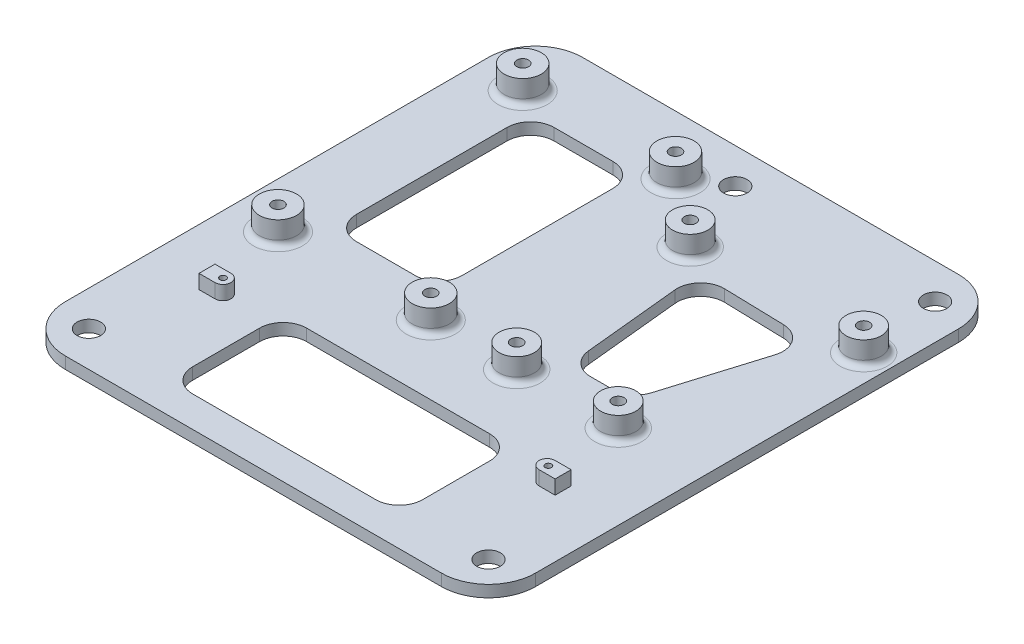
from build123d import *

# Parameters (mm, degrees)
BOSS_EXTRUDE5_DEPTH = 3.175
SKETCH2_R           = 5.0165
SKETCH2_R_2         = 1.5875
SKETCH2_R_3         = 4.7625
BOSS_EXTRUDE6_DEPTH = 6.35
CUT_EXTRUDE1_START  = -2.54
CUT_EXTRUDE1_DEPTH  = 2.54
SKETCH4_R           = 3.175
CUT_EXTRUDE2_DEPTH  = 3.175
FILLET1_R           = 1.5875
SKETCH5_R           = 0.8509
CUT_EXTRUDE3_DEPTH  = 6.35


with BuildPart() as part:
    # Sketch1 → Boss-Extrude5 (new body)
    with BuildSketch(Plane(origin=(0, 0, 0), x_dir=(1, 0, 0), z_dir=(0, 1, 0))):
        with BuildLine():
            Line((12.7, 0), (114.3, 0))
            ThreePointArc((114.3, 0), (123.280256121, -3.719743879), (127, -12.7))
            Line((127, -12.7), (127, -127))
            ThreePointArc((127, -127), (123.280256121, -135.980256121), (114.3, -139.7))
            Line((114.3, -139.7), (12.7, -139.7))
            ThreePointArc((12.7, -139.7), (3.719743879, -135.980256121), (0, -127))
            Line((0, -127), (0, -12.7))
            ThreePointArc((0, -12.7), (3.719743879, -3.719743879), (12.7, 0))
        make_face()
    extrude(amount=BOSS_EXTRUDE5_DEPTH)

    # Sketch2 → Boss-Extrude6 (add)
    # profile 1 of 10: a face of its own
    with BuildSketch(Plane(origin=(0, 3.175, 0), x_dir=(1, 0, 0), z_dir=(0, 1, 0))):
        with Locations(Location((12.3825, -15.84325, 0), (0, 0, 270))):
            Circle(SKETCH2_R)
        with Locations(Location((12.3825, -15.84325, 0), (0, 0, 270))):
            Circle(SKETCH2_R_2, mode=Mode.SUBTRACT)
    # profile 2 of 10: a face of its own
    with BuildSketch(Plane(origin=(0, 3.175, 0), x_dir=(1, 0, 0), z_dir=(0, 1, 0))):
        with Locations(Location((53.6575, -15.84325, 0), (0, 0, 270))):
            Circle(SKETCH2_R)
        with Locations(Location((53.6575, -15.84325, 0), (0, 0, 270))):
            Circle(SKETCH2_R_2, mode=Mode.SUBTRACT)
    # profile 3 of 10: a face of its own
    with BuildSketch(Plane(origin=(0, 3.175, 0), x_dir=(1, 0, 0), z_dir=(0, 1, 0))):
        with Locations(Location((71.628, -29.845, 0), (0, 0, 270))):
            Circle(SKETCH2_R_3)
        with Locations(Location((71.628, -29.845, 0), (0, 0, 270))):
            Circle(SKETCH2_R_2, mode=Mode.SUBTRACT)
    # profile 4 of 10: a face of its own
    with BuildSketch(Plane(origin=(0, 3.175, 0), x_dir=(1, 0, 0), z_dir=(0, 1, 0))):
        with Locations(Location((119.761, -31.115, 0), (0, 0, 270))):
            Circle(SKETCH2_R_3)
        with Locations(Location((119.761, -31.115, 0), (0, 0, 270))):
            Circle(SKETCH2_R_2, mode=Mode.SUBTRACT)
    # profile 5 of 10: a face of its own
    with BuildSketch(Plane(origin=(0, 3.175, 0), x_dir=(1, 0, 0), z_dir=(0, 1, 0))):
        with Locations(Location((104.267, -81.915, 0), (0, 0, 270))):
            Circle(SKETCH2_R_3)
        with Locations(Location((104.267, -81.915, 0), (0, 0, 270))):
            Circle(SKETCH2_R_2, mode=Mode.SUBTRACT)
    # profile 6 of 10: a face of its own
    with BuildSketch(Plane(origin=(0, 3.175, 0), x_dir=(1, 0, 0), z_dir=(0, 1, 0))):
        with Locations(Location((76.835, -81.915, 0), (0, 0, 270))):
            Circle(SKETCH2_R_3)
        with Locations(Location((76.835, -81.915, 0), (0, 0, 270))):
            Circle(SKETCH2_R_2, mode=Mode.SUBTRACT)
    # profile 7 of 10: a face of its own
    with BuildSketch(Plane(origin=(0, 3.175, 0), x_dir=(1, 0, 0), z_dir=(0, 1, 0))):
        with Locations(Location((53.6575, -81.94675, 0), (0, 0, 270))):
            Circle(SKETCH2_R)
        with Locations(Location((53.6575, -81.94675, 0), (0, 0, 270))):
            Circle(SKETCH2_R_2, mode=Mode.SUBTRACT)
    # profile 8 of 10: a face of its own
    with BuildSketch(Plane(origin=(0, 3.175, 0), x_dir=(1, 0, 0), z_dir=(0, 1, 0))):
        with Locations(Location((12.3825, -81.94675, 0), (0, 0, 270))):
            Circle(SKETCH2_R)
        with Locations(Location((12.3825, -81.94675, 0), (0, 0, 270))):
            Circle(SKETCH2_R_2, mode=Mode.SUBTRACT)
    # profile 9 of 10: a face of its own
    with BuildSketch(Plane(origin=(0, 3.175, 0), x_dir=(1, 0, 0), z_dir=(0, 1, 0))):
        with BuildLine():
            Line((15.24, -106.1339), (15.24, -101.8159))
            Line((15.24, -101.8159), (19.558, -101.8159))
            ThreePointArc((19.558, -101.8159), (21.717, -103.9749), (19.558, -106.1339))
            Line((19.558, -106.1339), (15.24, -106.1339))
        make_face()
    # profile 10 of 10: a face of its own
    with BuildSketch(Plane(origin=(0, 3.175, 0), x_dir=(1, 0, 0), z_dir=(0, 1, 0))):
        with BuildLine():
            Line((107.1118, -101.8159), (111.4298, -101.8159))
            Line((111.4298, -101.8159), (111.4298, -106.1339))
            Line((111.4298, -106.1339), (107.1118, -106.1339))
            ThreePointArc((107.1118, -106.1339), (104.9528, -103.9749), (107.1118, -101.8159))
        make_face()
    extrude(amount=BOSS_EXTRUDE6_DEPTH)

    # Sketch3 → Cut-Extrude1 (cut)
    with BuildSketch(Plane(origin=(0, 9.525, 0), x_dir=(1, 0, 0), z_dir=(0, 1, 0)).offset(CUT_EXTRUDE1_START)):
        with BuildLine():
            Line((19.558, -101.8159), (15.24, -101.8159))
            Line((15.24, -101.8159), (15.24, -106.1339))
            Line((15.24, -106.1339), (19.558, -106.1339))
            ThreePointArc((19.558, -106.1339), (21.717, -103.9749), (19.558, -101.8159))
        make_face()
        with BuildLine():
            Line((111.4298, -101.8159), (111.4298, -106.1339))
            Line((111.4298, -106.1339), (107.1118, -106.1339))
            ThreePointArc((107.1118, -106.1339), (104.9528, -103.9749), (107.1118, -101.8159))
            Line((107.1118, -101.8159), (111.4298, -101.8159))
        make_face()
    extrude(amount=CUT_EXTRUDE1_DEPTH, mode=Mode.SUBTRACT)

    # Sketch4 → Cut-Extrude2 (cut)
    with BuildSketch(Plane.XZ):
        with Locations(Location((117.475, 130.175, 0), (0, 0, 270))):
            Circle(SKETCH4_R)
        with Locations(Location((117.475, 9.525, 0), (0, 0, 270))):
            Circle(SKETCH4_R)
        with Locations(Location((9.525, 130.175, 0), (0, 0, 270))):
            Circle(SKETCH4_R)
        with Locations(Location((63.5, 9.525, 0), (0, 0, 270))):
            Circle(SKETCH4_R)
        with BuildLine():
            Line((32.423317369, 106.950716075), (32.423317369, 125.042120111))
            ThreePointArc((32.423317369, 125.042120111), (34.283189309, 129.532248172), (38.773317369, 131.392120111))
            Line((38.773317369, 131.392120111), (88.227117369, 131.392120111))
            ThreePointArc((88.227117369, 131.392120111), (92.71724543, 129.532248172), (94.577117369, 125.042120111))
            Line((94.577117369, 125.042120111), (94.577117369, 106.950716075))
            ThreePointArc((94.577117369, 106.950716075), (92.71724543, 102.460588015), (88.227117369, 100.600716075))
            Line((88.227117369, 100.600716075), (38.773317369, 100.600716075))
            ThreePointArc((38.773317369, 100.600716075), (34.283189309, 102.460588015), (32.423317369, 106.950716075))
        make_face()
        with BuildLine():
            Line((82.17517325, 67.888968727), (79.579189386, 41.929130088))
            ThreePointArc((79.579189386, 41.929130088), (81.246059, 36.974670742), (86.065163428, 34.949490691))
            Line((86.065163428, 34.949490691), (102.377701049, 35.379900654))
            ThreePointArc((102.377701049, 35.379900654), (107.362837459, 38.016497169), (108.283987857, 43.580192717))
            Line((108.283987857, 43.580192717), (100.497512111, 69.109621392))
            ThreePointArc((100.497512111, 69.109621392), (98.202567719, 72.360348655), (94.42373742, 73.607120111))
            Line((94.42373742, 73.607120111), (88.493659408, 73.607120111))
            ThreePointArc((88.493659408, 73.607120111), (84.232775621, 71.965343699), (82.17517325, 67.888968727))
        make_face()
        with BuildLine():
            Line((18.897817369, 26.585370111), (18.897817369, 67.288870111))
            ThreePointArc((18.897817369, 67.288870111), (20.757689309, 71.778998172), (25.247817369, 73.638870111))
            Line((25.247817369, 73.638870111), (41.122817369, 73.638870111))
            ThreePointArc((41.122817369, 73.638870111), (45.61294543, 71.778998172), (47.472817369, 67.288870111))
            Line((47.472817369, 67.288870111), (47.472817369, 26.585370111))
            ThreePointArc((47.472817369, 26.585370111), (45.61294543, 22.095242051), (41.122817369, 20.235370111))
            Line((41.122817369, 20.235370111), (25.247817369, 20.235370111))
            ThreePointArc((25.247817369, 20.235370111), (20.757689309, 22.095242051), (18.897817369, 26.585370111))
        make_face()
    extrude(amount=-CUT_EXTRUDE2_DEPTH, mode=Mode.SUBTRACT)

    # Fillet1
    fillet1_edges = [part.edges().sort_by_distance(p)[0] for p in [
        (12.3825, 3.175, 10.82675),
        (53.6575, 3.175, 10.82675),
        (71.628, 3.175, 25.0825),
        (119.761, 3.175, 26.3525),
        (104.267, 3.175, 77.1525),
        (76.835, 3.175, 77.1525),
        (53.6575, 3.175, 76.93025),
        (12.3825, 3.175, 76.93025),
    ]]
    fillet(fillet1_edges, radius=FILLET1_R)

    # Sketch5 → Cut-Extrude3 (cut)
    with BuildSketch(Plane(origin=(0, 6.985, 0), x_dir=(1, 0, 0), z_dir=(0, 1, 0))):
        with Locations(Location((107.442434738, -103.9749, 0), (0, 0, 90))):
            Circle(SKETCH5_R)
        with Locations(Location((19.558, -103.9749, 0), (0, 0, 270))):
            Circle(SKETCH5_R)
    extrude(amount=-CUT_EXTRUDE3_DEPTH, mode=Mode.SUBTRACT)


solid = part.part
